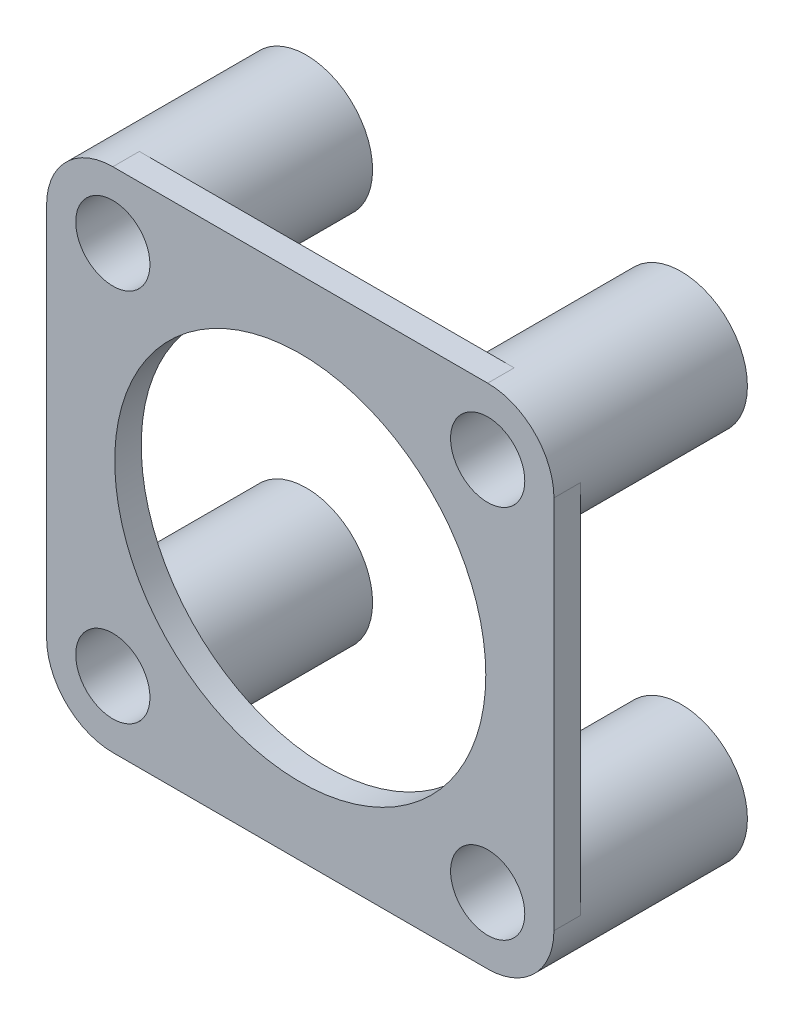
from build123d import *
from build123d.topology import SkipClean

# Parameters (mm, degrees)
SKETCH1_R             = 2.5
SKETCH1_R_2           = 1.4
BOSS_EXTRUDE1_DEPTH   = 6.3
BOSS_EXTRUDE1_2_DEPTH = 6.3
BOSS_EXTRUDE1_3_DEPTH = 6.3
BOSS_EXTRUDE1_4_DEPTH = 6.3
SKETCH2_R             = 1.4
SKETCH2_R_2           = 7
BOSS_EXTRUDE2_DEPTH   = 1


with BuildPart() as part:
    # Sketch1 → Boss-Extrude1 (new body)
    with BuildSketch(Plane.XY):
        with Locations((-7.071067812, 7.071067812)):
            Circle(SKETCH1_R)
        with Locations((-7.071067812, 7.071067812)):
            Circle(SKETCH1_R_2, mode=Mode.SUBTRACT)
    extrude(amount=BOSS_EXTRUDE1_DEPTH)



with BuildPart() as body_2:
    # Sketch1 → Boss-Extrude1 2 (new body)
    with BuildSketch(Plane.XY):
        with Locations((7.071067812, 7.071067812)):
            Circle(SKETCH1_R)
        with Locations((7.071067812, 7.071067812)):
            Circle(SKETCH1_R_2, mode=Mode.SUBTRACT)
    extrude(amount=BOSS_EXTRUDE1_2_DEPTH)


with BuildPart() as body_3:
    # Sketch1 → Boss-Extrude1 3 (new body)
    with BuildSketch(Plane.XY):
        with Locations((7.071067812, -7.071067812)):
            Circle(SKETCH1_R)
        with Locations((7.071067812, -7.071067812)):
            Circle(SKETCH1_R_2, mode=Mode.SUBTRACT)
    extrude(amount=BOSS_EXTRUDE1_3_DEPTH)


with BuildPart() as body_4:
    # Sketch1 → Boss-Extrude1 4 (new body)
    with BuildSketch(Plane.XY):
        with Locations((-7.071067812, -7.071067812)):
            Circle(SKETCH1_R)
        with Locations((-7.071067812, -7.071067812)):
            Circle(SKETCH1_R_2, mode=Mode.SUBTRACT)
    extrude(amount=BOSS_EXTRUDE1_4_DEPTH)


with BuildPart() as part_1:
    with SkipClean():  # the faces are left unmerged after this step: merging them gives an invalid solid
        add(part.part)

        add(body_2.part)  # Boss-Extrude2 merges body 2

        add(body_3.part)  # Boss-Extrude2 merges body 3

        add(body_4.part)  # Boss-Extrude2 merges body 4
        # Sketch2 → Boss-Extrude2 (add)
        with BuildSketch(Plane.XY.offset(6.3)):
            with BuildLine():
                Line((-9.571067812, 7.071067812), (-9.571067812, -7.071067812))
                ThreePointArc((-9.571067812, -7.071067812), (-8.838834765, -8.838834765), (-7.071067812, -9.571067812))
                Line((-7.071067812, -9.571067812), (7.071067812, -9.571067812))
                ThreePointArc((7.071067812, -9.571067812), (8.838834765, -8.838834765), (9.571067812, -7.071067812))
                Line((9.571067812, -7.071067812), (9.571067812, 7.071067812))
                ThreePointArc((9.571067812, 7.071067812), (8.838834765, 8.838834765), (7.071067812, 9.571067812))
                Line((7.071067812, 9.571067812), (-7.071067812, 9.571067812))
                ThreePointArc((-7.071067812, 9.571067812), (-8.838834765, 8.838834765), (-9.571067812, 7.071067812))
            make_face()
            with Locations((7.071067812, -7.071067812)):
                Circle(SKETCH2_R, mode=Mode.SUBTRACT)
            with Locations((7.071067812, 7.071067812)):
                Circle(SKETCH2_R, mode=Mode.SUBTRACT)
            with Locations((-7.071067812, -7.071067812)):
                Circle(SKETCH2_R, mode=Mode.SUBTRACT)
            with Locations((-7.071067812, 7.071067812)):
                Circle(SKETCH2_R, mode=Mode.SUBTRACT)
            Circle(SKETCH2_R_2, mode=Mode.SUBTRACT)
        extrude(amount=BOSS_EXTRUDE2_DEPTH)


solid = part_1.part
